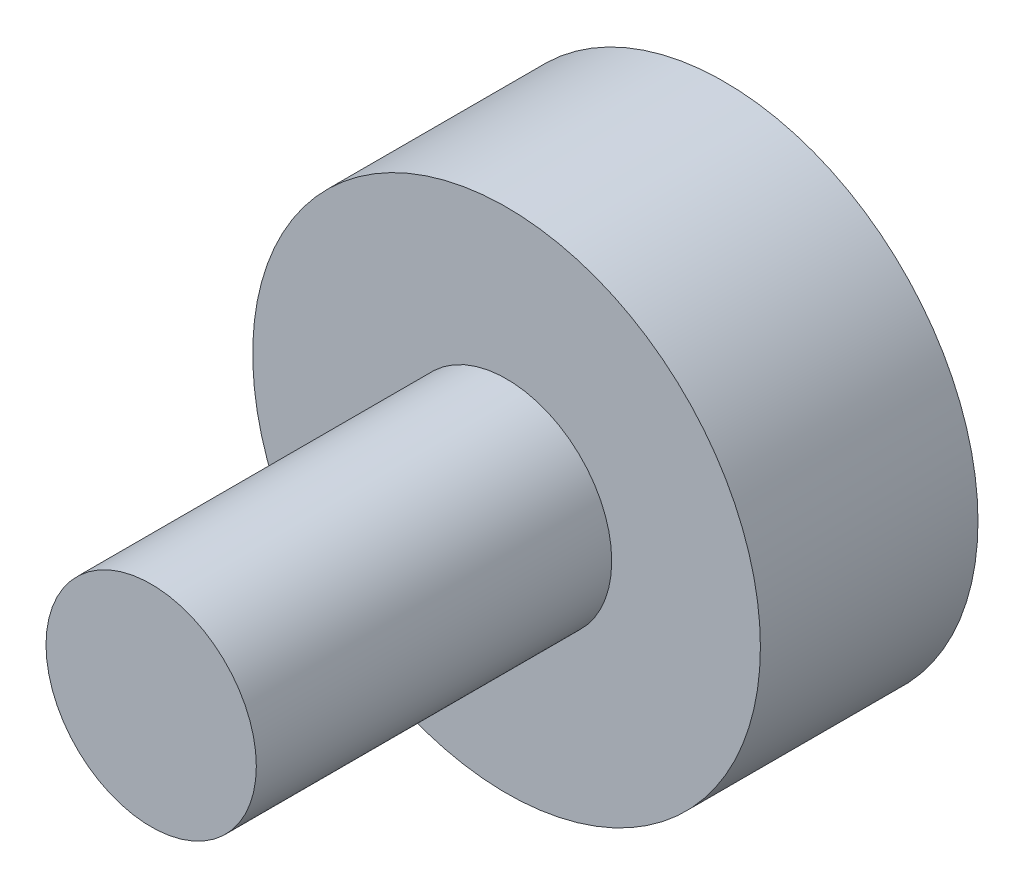
from build123d import *

# Parameters (mm, degrees)
SKETCH1_R           = 3.5
BOSS_EXTRUDE1_DEPTH = 3
SKETCH2_R           = 1.45
BOSS_EXTRUDE2_DEPTH = 4.9


with BuildPart() as part:
    # Sketch1 → Boss-Extrude1 (new body)
    with BuildSketch(Plane.XY):
        Circle(SKETCH1_R)
    extrude(amount=BOSS_EXTRUDE1_DEPTH)

    # Sketch2 → Boss-Extrude2 (add)
    with BuildSketch(Plane.XY.offset(3)):
        Circle(SKETCH2_R)
    extrude(amount=BOSS_EXTRUDE2_DEPTH)


solid = part.part
